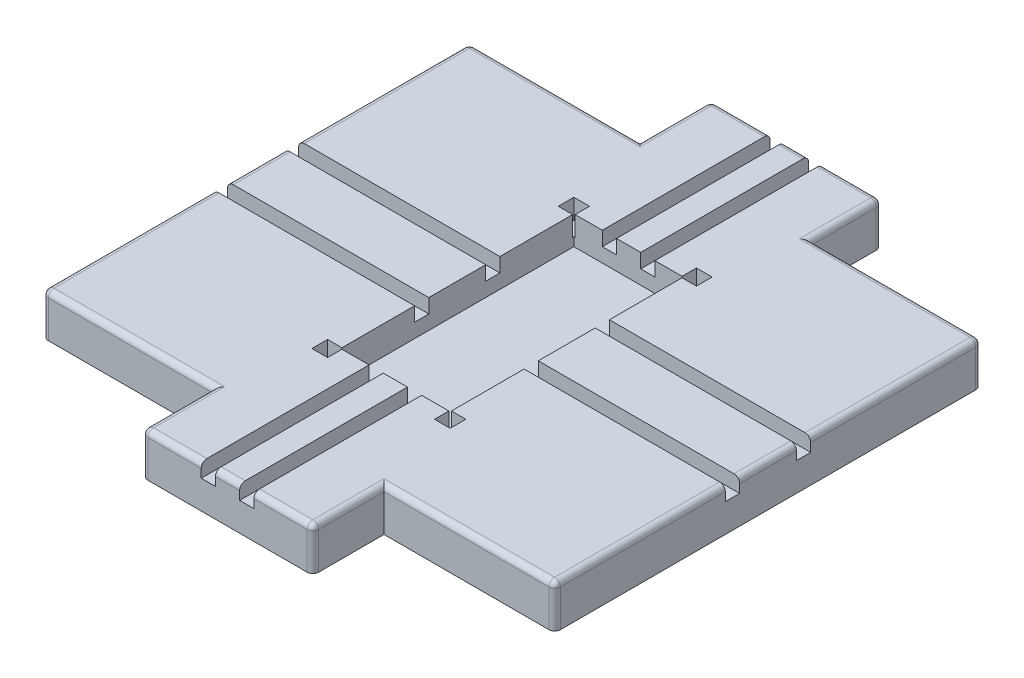
from build123d import *

# Parameters (mm, degrees)
SKETCH1_W                                  = 180
SKETCH1_H                                  = 150
BOSS_EXTRUDE1_DEPTH                        = 15
SKETCH7_W                                  = 60
SKETCH7_H                                  = 25
BOSS_EXTRUDE6_DEPTH                        = 15
FILLET1_R                                  = 2
SKETCH2_W                                  = 38.5
SKETCH2_H                                  = 82
CUT_EXTRUDE1_DEPTH                         = 10
CUT_EXTRUDE3_DEPTH                         = 5
SKETCH11_W                                 = 5.5
SKETCH11_H                                 = 5.5
CUT_EXTRUDE6_DEPTH                         = 7
MIRROR3_AT_THE_SECOND_PLANE_COPY_1_SKETC_W = 5.5
MIRROR3_AT_THE_SECOND_PLANE_COPY_1_SKETC_H = 5.5
MIRROR3_AT_THE_SECOND_PLANE_COPY_1_DEPTH   = 7
MIRROR4_AT_THE_SECOND_PLANE_COPY_1_DEPTH   = 5


with BuildPart() as part:
    # Sketch1 → Boss-Extrude1 (new body)
    with BuildSketch(Plane(origin=(0, 0, 0), x_dir=(1, 0, 0), z_dir=(0, 1, 0))):
        Rectangle(SKETCH1_W, SKETCH1_H)
    extrude(amount=BOSS_EXTRUDE1_DEPTH)

    # Sketch7 → Boss-Extrude6 (add)
    with BuildSketch(Plane(origin=(0, 0, 0), x_dir=(1, 0, 0), z_dir=(0, 1, 0))):
        with Locations((0, -87.5)):
            Rectangle(SKETCH7_W, SKETCH7_H)
        with Locations((0, 87.5)):
            Rectangle(SKETCH7_W, SKETCH7_H)
    extrude(amount=BOSS_EXTRUDE6_DEPTH)

    # Fillet1
    fillet1_edges = [part.edges().sort_by_distance(p)[0] for p in [
        (-90, 15, 0),
        (60, 15, 75),
        (-60, 15, 75),
        (-30, 7.5, 100),
        (30, 7.5, 100),
        (-30, 15, 87.5),
        (0, 15, 100),
        (30, 15, 87.5),
        (-60, 15, -75),
        (0, 15, -100),
        (30, 7.5, -100),
        (-30, 15, -87.5),
        (-30, 7.5, -100),
        (30, 15, -87.5),
        (90, 15, 0),
        (90, 7.5, 75),
        (-90, 7.5, 75),
        (-90, 7.5, -75),
        (90, 7.5, -75),
        (60, 15, -75),
    ]]
    fillet(fillet1_edges, radius=FILLET1_R)

    # Sketch2 → Cut-Extrude1 (cut)
    with BuildSketch(Plane(origin=(0, 15, 0), x_dir=(1, 0, 0), z_dir=(0, 1, 0))):
        Rectangle(SKETCH2_W, SKETCH2_H)
    extrude(amount=-CUT_EXTRUDE1_DEPTH, mode=Mode.SUBTRACT)

    # Sketch10 → Cut-Extrude3 (cut)
    with BuildSketch(Plane(origin=(0, 15, 0), x_dir=(1, 0, 0), z_dir=(0, 1, 0))):
        Polygon((-9.25, -40.5), (-9.25, -33.162899401), (-4.25, -33.162899401), (-4.25, -40.5), (-4.25, -105.687952047), (-9.25, -105.687952047), align=None)
        Polygon((-99.022946063, 15), (-19.25, 15), (-11.555108838, 15), (-11.555108838, 10), (-19.25, 10), (-99.022946063, 10), align=None)
    cut_extrude3 = extrude(amount=-CUT_EXTRUDE3_DEPTH, mode=Mode.SUBTRACT)

    # Sketch11 → Cut-Extrude6 (cut)
    with BuildSketch(Plane(origin=(0, 15, 0), x_dir=(1, 0, 0), z_dir=(0, 1, 0))):
        with Locations((-21.549732367, 43.299732367)):
            Rectangle(SKETCH11_W, SKETCH11_H)
    cut_extrude6 = extrude(amount=-CUT_EXTRUDE6_DEPTH, mode=Mode.SUBTRACT)

    # Mirror3: Cut-Extrude6 across plane
    add(cut_extrude6.mirror(Plane(origin=(0, 0, 0), x_dir=(0, 0, 1), z_dir=(1, 0, 0))), mode=Mode.SUBTRACT)

    # Mirror3 at the second plane: Cut-Extrude6 across plane
    add(cut_extrude6.mirror(Plane.XY), mode=Mode.SUBTRACT)

    # Mirror3 at the second plane copy 1 sketc → Mirror3 at the second plane copy 1 (cut)
    with BuildSketch(Plane(origin=(0, 15, 0), x_dir=(-1, 0, 0), z_dir=(0, 1, 0))):
        with Locations((-21.549732367, 43.299732367)):
            Rectangle(MIRROR3_AT_THE_SECOND_PLANE_COPY_1_SKETC_W, MIRROR3_AT_THE_SECOND_PLANE_COPY_1_SKETC_H)
    extrude(amount=-MIRROR3_AT_THE_SECOND_PLANE_COPY_1_DEPTH, mode=Mode.SUBTRACT)

    # Mirror4: Cut-Extrude3 across plane
    add(cut_extrude3.mirror(Plane(origin=(0, 0, 0), x_dir=(0, 0, 1), z_dir=(1, 0, 0))), mode=Mode.SUBTRACT)

    # Mirror4 at the second plane: Cut-Extrude3 across plane
    add(cut_extrude3.mirror(Plane.XY), mode=Mode.SUBTRACT)

    # Mirror4 at the second plane copy 1 sketc → Mirror4 at the second plane copy 1 (cut)
    with BuildSketch(Plane(origin=(0, 15, 0), x_dir=(-1, 0, 0), z_dir=(0, 1, 0))):
        Polygon((-9.25, -40.5), (-9.25, -33.162899401), (-4.25, -33.162899401), (-4.25, -40.5), (-4.25, -105.687952047), (-9.25, -105.687952047), align=None)
        Polygon((-99.022946063, 15), (-19.25, 15), (-11.555108838, 15), (-11.555108838, 10), (-19.25, 10), (-99.022946063, 10), align=None)
    extrude(amount=-MIRROR4_AT_THE_SECOND_PLANE_COPY_1_DEPTH, mode=Mode.SUBTRACT)


solid = part.part
